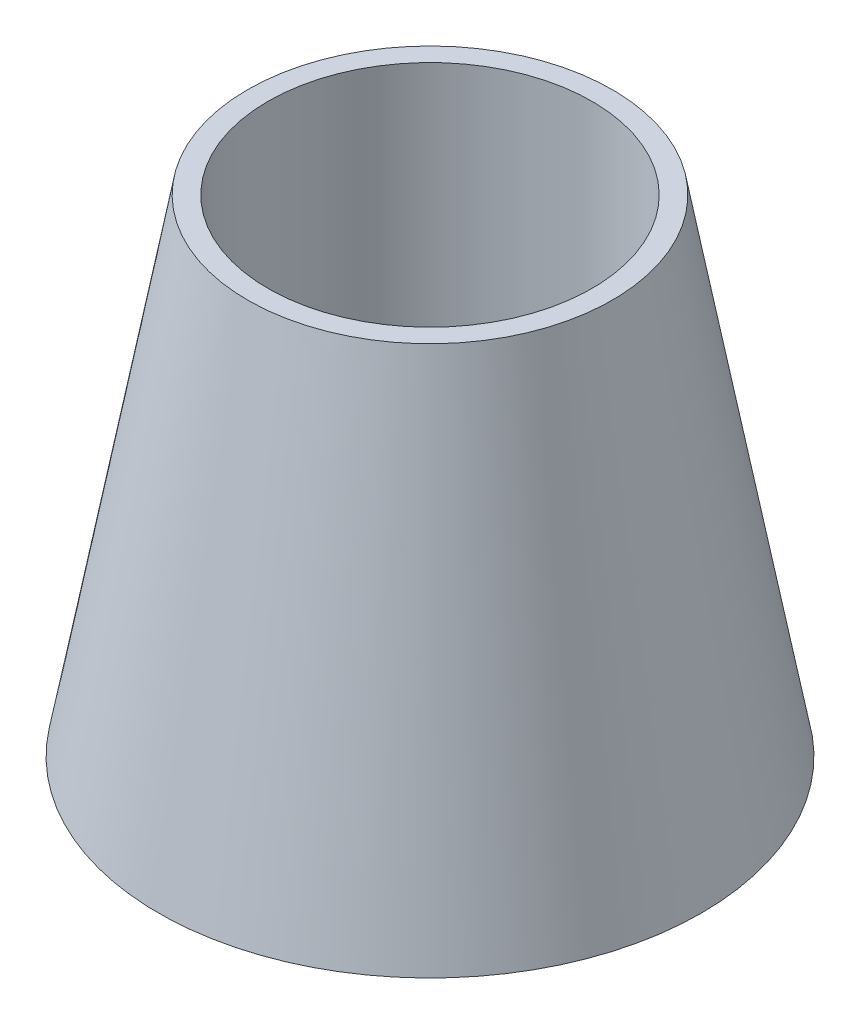
from build123d import *

# Parameters (mm, degrees)
CUT_EXTRUDE1_REACH = 191.239
SKETCH2_R          = 3.175


with BuildPart() as part:
    # Sketch1 → Revolve1 (revolve)
    with BuildSketch(Plane.XY):
        with BuildLine():
            Line((0, 0), (-78.74, 0))
            Line((-78.74, 0), (-85.09, 0))
            Line((-85.09, 0), (-57.15, 152.4))
            Line((-57.15, 152.4), (-50.8, 152.4))
            Line((-50.8, 152.4), (-50.8, 8.89))
            ThreePointArc((-50.8, 8.89), (-50.056051224, 7.093948776), (-48.26, 6.35))
            Line((-48.26, 6.35), (0, 6.35))
            Line((0, 6.35), (0, 0))
        make_face()
        with BuildLine():
            Line((-57.15, 8.89), (-57.15, 117.763636364))
            Line((-57.15, 117.763636364), (-77.026193989, 9.348032787))
            ThreePointArc((-77.026193989, 9.348032787), (-76.479115384, 7.263931625), (-74.527833333, 6.35))
            Line((-74.527833333, 6.35), (-59.69, 6.35))
            ThreePointArc((-59.69, 6.35), (-57.893948776, 7.093948776), (-57.15, 8.89))
        make_face(mode=Mode.SUBTRACT)
    revolve(axis=Axis((0, 152.4, 0), (0, -1, 0)))

    # Sketch2 → Cut-Extrude1 (cut, up to next)
    with BuildSketch(Plane(origin=(0, 6.35, 0), x_dir=(1, 0, 0), z_dir=(0, 1, 0)), mode=Mode.PRIVATE) as cut_extrude1_sk1:
        with Locations(Location((0, 0, 0), (0, 0, 180))):
            Circle(SKETCH2_R)
    cut_extrude1_tool1 = extrude(cut_extrude1_sk1.sketch, amount=-CUT_EXTRUDE1_REACH, mode=Mode.PRIVATE) & part.part
    # Sketch2 → Cut-Extrude1 (cut, up to next)
    with BuildSketch(Plane(origin=(0, 6.35, 0), x_dir=(1, 0, 0), z_dir=(0, 1, 0)), mode=Mode.PRIVATE) as cut_extrude1_sk2:
        with Locations(Location((25.4, 0, 0), (0, 0, 180))):
            Circle(SKETCH2_R)
    cut_extrude1_tool2 = extrude(cut_extrude1_sk2.sketch, amount=-CUT_EXTRUDE1_REACH, mode=Mode.PRIVATE) & part.part
    # Sketch2 → Cut-Extrude1 (cut, up to next)
    with BuildSketch(Plane(origin=(0, 6.35, 0), x_dir=(1, 0, 0), z_dir=(0, 1, 0)), mode=Mode.PRIVATE) as cut_extrude1_sk3:
        with Locations(Location((-25.4, 0, 0), (0, 0, 180))):
            Circle(SKETCH2_R)
    cut_extrude1_tool3 = extrude(cut_extrude1_sk3.sketch, amount=-CUT_EXTRUDE1_REACH, mode=Mode.PRIVATE) & part.part
    add(cut_extrude1_tool1.solids().sort_by_distance((0, 6.35, 0))[0], mode=Mode.SUBTRACT)
    add(cut_extrude1_tool2.solids().sort_by_distance((25.4, 6.35, 0))[0], mode=Mode.SUBTRACT)
    add(cut_extrude1_tool3.solids().sort_by_distance((-25.4, 6.35, 0))[0], mode=Mode.SUBTRACT)


solid = part.part
